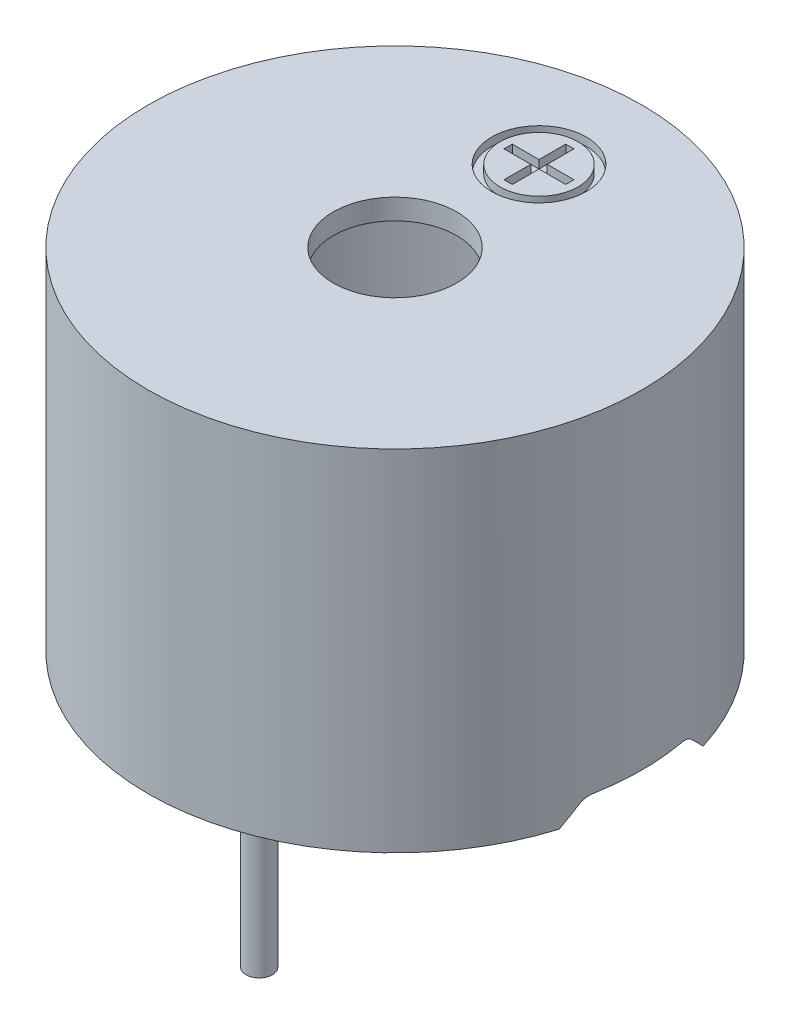
from build123d import *

# Parameters (mm, degrees)
SKETCH1_R               = 6
BOSS_EXTRUDE1_DEPTH     = 8.5
SKETCH2_R               = 5.5
CUT_EXTRUDE1_DEPTH      = 8
CUT_EXTRUDE2_REACH      = 14.01
SKETCH3_R               = 1.5
SKETCH4_R               = 1.15
SKETCH4_R_2             = 0.95
SKETCH4_W               = 1.5
SKETCH4_H               = 0.2
SKETCH4_W_2             = 0.2
SKETCH4_H_2             = 1.5
CUT_EXTRUDE_THIN1_DEPTH = 0.2
CUT_EXTRUDE3_DEPTH      = 16.882380174
SKETCH6_R               = 5.5
SKETCH6_R_2             = 0.32
BOARD_EXTRUDE_DEPTH     = 0.2
SKETCH7_R               = 0.32
PINS_DEPTH              = 6.2
PINS_2_DEPTH            = 6.2
SKETCH8_R               = 2.5
QUARTZ_EXTRUDE_DEPTH    = 1
SKETCH9_R               = 5
PLATE_EXTRUDE_DEPTH     = 0.1


with BuildPart() as part:
    # Sketch1 → Boss-Extrude1 (new body)
    with BuildSketch(Plane(origin=(0, 0, 0), x_dir=(1, 0, 0), z_dir=(0, 1, 0))):
        with Locations(Location((0, 0, 0), (0, 0, 270))):
            Circle(SKETCH1_R)
    extrude(amount=BOSS_EXTRUDE1_DEPTH)

    # Sketch2 → Cut-Extrude1 (cut)
    with BuildSketch(Plane(origin=(0, 0, 0), x_dir=(-1, 0, 0), z_dir=(0, -1, 0))):
        with Locations(Location((0, 0, 0), (0, 0, 90))):
            Circle(SKETCH2_R)
    extrude(amount=-CUT_EXTRUDE1_DEPTH, mode=Mode.SUBTRACT)

    # Sketch3 → Cut-Extrude2 (cut, up to next)
    with BuildSketch(Plane(origin=(0, 8.5, 0), x_dir=(1, 0, 0), z_dir=(0, 1, 0)), mode=Mode.PRIVATE) as cut_extrude2_sk1:
        with Locations(Location((0, 0, 0), (0, 0, 270))):
            Circle(SKETCH3_R)
    cut_extrude2_tool1 = extrude(cut_extrude2_sk1.sketch, amount=-CUT_EXTRUDE2_REACH, mode=Mode.PRIVATE) & part.part
    add(cut_extrude2_tool1.solids().sort_by_distance((0, 8.5, 0))[0], mode=Mode.SUBTRACT)

    # Sketch4 → Cut-Extrude-Thin1 (cut)
    # profile 1 of 3: a face of its own
    with BuildSketch(Plane(origin=(0, 8.5, 0), x_dir=(1, 0, 0), z_dir=(0, 1, 0))):
        with Locations((0, 3.5)):
            Circle(SKETCH4_R)
        with Locations((0, 3.5)):
            Circle(SKETCH4_R_2, mode=Mode.SUBTRACT)
    # profile 2 of 3: a face of its own
    with BuildSketch(Plane(origin=(0, 8.5, 0), x_dir=(1, 0, 0), z_dir=(0, 1, 0))):
        with Locations((0, 3.5)):
            Rectangle(SKETCH4_W, SKETCH4_H)
    # profile 3 of 3: a face of its own
    with BuildSketch(Plane(origin=(0, 8.5, 0), x_dir=(1, 0, 0), z_dir=(0, 1, 0))):
        with Locations((0, 3.5)):
            Rectangle(SKETCH4_W_2, SKETCH4_H_2)
    extrude(amount=-CUT_EXTRUDE_THIN1_DEPTH, mode=Mode.SUBTRACT)

    # Sketch5 → Cut-Extrude3 (cut, through all)
    with BuildSketch(Plane(origin=(6, 0, 0), x_dir=(0, 0, -1), z_dir=(1, 0, 0))):
        with BuildLine():
            Line((-1.084314575, 0.5), (1.084314575, 0.5))
            ThreePointArc((1.084314575, 0.5), (1.237387948, 0.469551813), (1.367157288, 0.382842712))
            Line((1.367157288, 0.382842712), (1.75, 0))
            Line((1.75, 0), (-1.75, 0))
            Line((-1.75, 0), (-1.367157288, 0.382842712))
            ThreePointArc((-1.367157288, 0.382842712), (-1.237387948, 0.469551813), (-1.084314575, 0.5))
        make_face()
    extrude(amount=-CUT_EXTRUDE3_DEPTH, mode=Mode.SUBTRACT)


with BuildPart() as body_2:
    # Sketch6 → Board extrude (new body)
    with BuildSketch(Plane(origin=(0, 1, 0), x_dir=(1, 0, 0), z_dir=(0, 1, 0))):
        with Locations(Location((0, 0, 0), (0, 0, 270))):
            Circle(SKETCH6_R)
        with Locations(Location((0, 3.3, 0), (0, 0, 270))):
            Circle(SKETCH6_R_2, mode=Mode.SUBTRACT)
        with Locations(Location((0, -3.3, 0), (0, 0, 270))):
            Circle(SKETCH6_R_2, mode=Mode.SUBTRACT)
    extrude(amount=BOARD_EXTRUDE_DEPTH)


with BuildPart() as body_3:
    # Sketch7 → Pins (new body)
    with BuildSketch(Plane(origin=(0, 1.2, 0), x_dir=(1, 0, 0), z_dir=(0, 1, 0))):
        with Locations(Location((0, 3.3, 0), (0, 0, 270))):
            Circle(SKETCH7_R)
    extrude(amount=-PINS_DEPTH)


with BuildPart() as body_4:
    # Sketch7 → Pins 2 (new body)
    with BuildSketch(Plane(origin=(0, 1.2, 0), x_dir=(1, 0, 0), z_dir=(0, 1, 0))):
        with Locations(Location((0, -3.3, 0), (0, 0, 270))):
            Circle(SKETCH7_R)
    extrude(amount=-PINS_2_DEPTH)


with BuildPart() as body_5:
    # Sketch8 → Quartz extrude (new body)
    with BuildSketch(Plane(origin=(0, 1.2, 0), x_dir=(1, 0, 0), z_dir=(0, 1, 0))):
        with Locations(Location((0, 0, 0), (0, 0, 270))):
            Circle(SKETCH8_R)
    extrude(amount=QUARTZ_EXTRUDE_DEPTH)


with BuildPart() as body_6:
    # Sketch9 → Plate extrude (new body)
    with BuildSketch(Plane(origin=(0, 2.2, 0), x_dir=(1, 0, 0), z_dir=(0, 1, 0))):
        with Locations(Location((0, 0, 0), (0, 0, 270))):
            Circle(SKETCH9_R)
    extrude(amount=PLATE_EXTRUDE_DEPTH)


solid = Compound([part.part, body_2.part, body_3.part, body_4.part, body_5.part, body_6.part])
